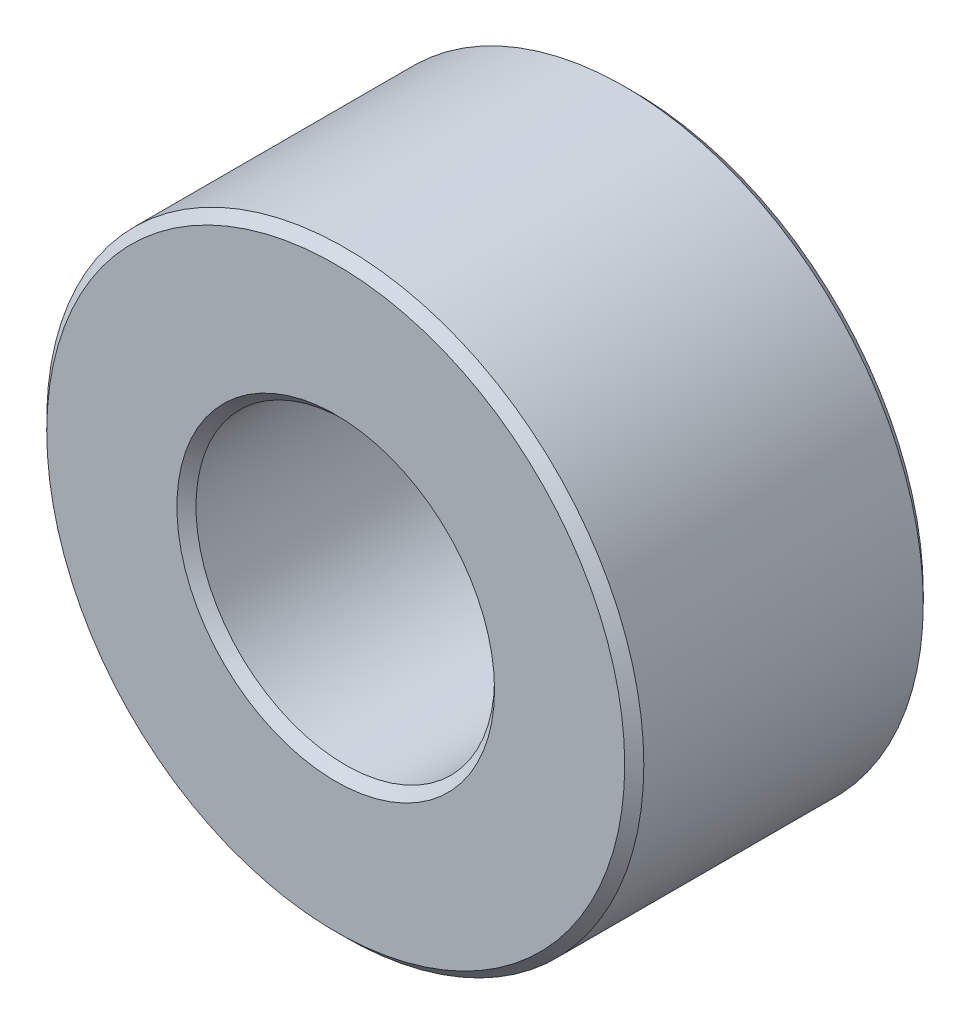
from build123d import *

# Parameters (mm, degrees)
SKETCH1_R           = 7.9375
BOSS_EXTRUDE1_DEPTH = 7.9375
SKETCH2_R           = 3.96875
CUT_EXTRUDE1_DEPTH  = 7.9375
CHAMFER1_SIZE       = 0.254


with BuildPart() as part:
    # Sketch1 → Boss-Extrude1 (new body)
    with BuildSketch(Plane.XY):
        Circle(SKETCH1_R)
    extrude(amount=BOSS_EXTRUDE1_DEPTH)

    # Sketch2 → Cut-Extrude1 (cut)
    with BuildSketch(Plane.XY.offset(7.9375)):
        Circle(SKETCH2_R)
    extrude(amount=-CUT_EXTRUDE1_DEPTH, mode=Mode.SUBTRACT)

    # Chamfer1
    chamfer1_edges = [part.edges().sort_by_distance(p)[0] for p in [
        (-7.9375, 0, 0),
        (-7.9375, 0, 7.9375),
        (-3.96875, 0, 0),
        (-3.96875, 0, 7.9375),
    ]]
    chamfer(chamfer1_edges, length=CHAMFER1_SIZE)


solid = part.part
